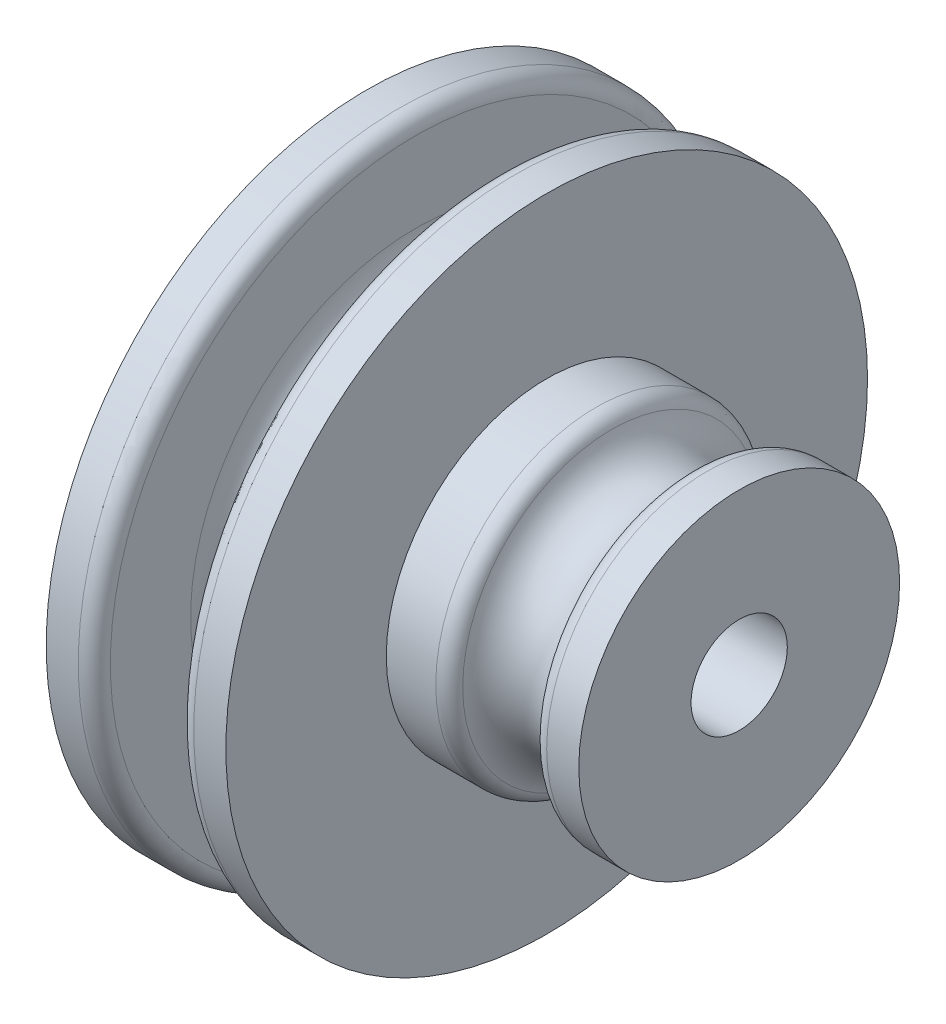
from build123d import *

# Parameters (mm, degrees)
SKETCH2_R          = 1.5
CUT_EXTRUDE2_DEPTH = 19.290981439


with BuildPart() as part:
    # Sketch1 → Revolve1 (revolve)
    with BuildSketch(Plane(origin=(0, 0, 0), x_dir=(-1, 0, 0), z_dir=(0, 1, 0))):
        with BuildLine():
            Line((-5.6, 5), (-5.6, 0))
            Line((-5.6, 0), (0, 0))
            Line((0, 0), (0, 10))
            Line((0, 10), (-1, 10))
            ThreePointArc((-1, 10), (-1.353553391, 9.853553391), (-1.5, 9.5))
            Line((-1.5, 9.5), (-1.5, 7))
            ThreePointArc((-1.5, 7), (-2.8, 5.7), (-4.1, 7))
            Line((-4.1, 7), (-4.1, 9.5))
            ThreePointArc((-4.1, 9.5), (-4.246446609, 9.853553391), (-4.6, 10))
            Line((-4.6, 10), (-5.6, 10))
            Line((-5.6, 10), (-5.6, 5))
        make_face()
    revolve(axis=Axis((11.6, 0, 0), (-1, 0, 0)))

    # Sketch1<3> → Revolve2 (revolve)
    with BuildSketch(Plane(origin=(0, 0, 0), x_dir=(-1, 0, 0), z_dir=(0, 1, 0))):
        with BuildLine():
            Line((-11.6, 5), (-11.6, 0))
            Line((-11.6, 0), (-5.6, 0))
            Line((-5.6, 0), (-5.6, 5))
            Line((-5.6, 5), (-7.141676707, 5))
            ThreePointArc((-7.141676707, 5), (-7.442139313, 4.899652627), (-7.621999386, 4.638888889))
            ThreePointArc((-7.621999386, 4.638888889), (-8.870838353, 3.7), (-10.11967732, 4.638888889))
            ThreePointArc((-10.11967732, 4.638888889), (-10.299537394, 4.899652627), (-10.6, 5))
            Line((-10.6, 5), (-11.6, 5))
        make_face()
    revolve(axis=Axis((11.6, 0, 0), (-1, 0, 0)))

    # Sketch2 → Cut-Extrude2 (cut, through all)
    with BuildSketch(Plane.YZ):
        Circle(SKETCH2_R)
    extrude(amount=CUT_EXTRUDE2_DEPTH, mode=Mode.SUBTRACT)


solid = part.part
